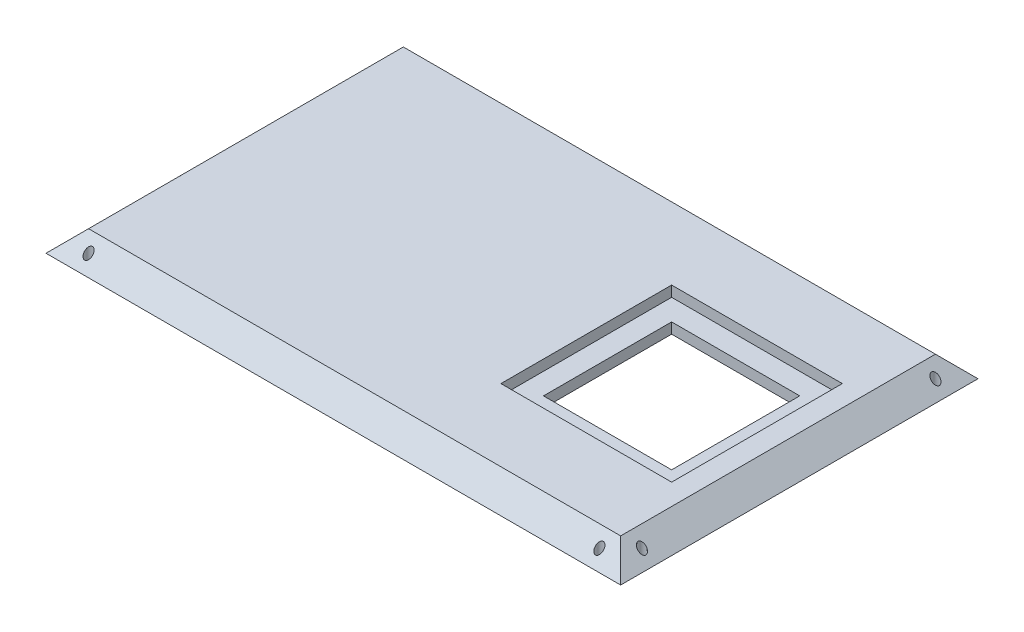
from build123d import *

# Parameters (mm, degrees)
SKETCH_3_R          = 1.85
CUT_EXTRUDE_1_DEPTH = 160.279136005


with BuildPart() as part:
    # Эскиз1 → Loft 1 section 0
    with BuildSketch(Plane(origin=(0, 0, 0), x_dir=(1, 0, 0), z_dir=(0, 1, 0))):
        with BuildLine():
            Line((-134.995764294, -83.940376122), (134.995764294, -83.940376122))
            Line((134.995764294, -83.940376122), (134.995764294, 83.940376122))
            Line((134.995764294, 83.940376122), (-134.995764294, 83.940376122))
            Line((-134.995764294, 83.940376122), (-134.995764294, -83.940376122))
        make_face()
    # Эскиз2 → Loft 1 section 1
    with BuildSketch(Plane(origin=(0, 10, 0), x_dir=(1, 0, 0), z_dir=(0, 1, 0))):
        with BuildLine():
            Line((-124.995764294, 73.940376122), (-124.995764294, -73.940376122))
            Line((-124.995764294, -73.940376122), (124.995764294, -73.940376122))
            Line((124.995764294, -73.940376122), (124.995764294, 73.940376122))
            Line((124.995764294, 73.940376122), (-124.995764294, 73.940376122))
        make_face()
    loft()

    # Эскиз3 → Вырез-Вытянуть1 (cut, through all)
    with BuildSketch(Plane.XZ):
        with Locations(Location((-119.995764294, 78.940376122, 0), (0, 0, 270))):
            Circle(SKETCH_3_R)
        with Locations(Location((-129.995764294, 68.940376122, 0), (0, 0, 180))):
            Circle(SKETCH_3_R)
        with Locations(Location((129.995764294, 68.940376122, 0), (0, 0, 270))):
            Circle(SKETCH_3_R)
        with Locations(Location((119.995764294, 78.940376122, 0), (0, 0, 90))):
            Circle(SKETCH_3_R)
        with Locations((129.995764294, -68.940376122)):
            Circle(SKETCH_3_R)
        with Locations(Location((119.995764294, -78.940376122, 0), (0, 0, 270))):
            Circle(SKETCH_3_R)
        with Locations(Location((-129.995764294, -68.940376122, 0), (0, 0, 270))):
            Circle(SKETCH_3_R)
        with Locations(Location((-119.995764294, -78.940376122, 0), (0, 0, 270))):
            Circle(SKETCH_3_R)
    extrude(amount=-CUT_EXTRUDE_1_DEPTH, mode=Mode.SUBTRACT)

    # Эскиз7 → Loft 1 2 section 0
    with BuildSketch(Plane(origin=(0, 0, 0), x_dir=(1, 0, 0), z_dir=(0, 1, 0))):
        with BuildLine():
            Line((105.095764294, -30.1), (105.095764294, 30.1))
            Line((105.095764294, 30.1), (44.895764294, 30.1))
            Line((44.895764294, 30.1), (44.895764294, -30.1))
            Line((44.895764294, -30.1), (105.095764294, -30.1))
        make_face()
    # Эскиз6 → Loft 1 2 section 1
    with BuildSketch(Plane(origin=(0, 5, 0), x_dir=(1, 0, 0), z_dir=(0, 1, 0))):
        with BuildLine():
            Line((105.095764294, -30.1), (44.895764294, -30.1))
            Line((44.895764294, -30.1), (44.895764294, 30.1))
            Line((44.895764294, 30.1), (105.095764294, 30.1))
            Line((105.095764294, 30.1), (105.095764294, -30.1))
        make_face()
    loft(mode=Mode.SUBTRACT)

    # Эскиз6<3> → Вырез-По сечениям2 section 0
    with BuildSketch(Plane(origin=(0, 5, 0), x_dir=(1, 0, 0), z_dir=(0, 1, 0))):
        with BuildLine():
            Line((115.095764294, 40.1), (34.895764294, 40.1))
            Line((34.895764294, 40.1), (34.895764294, -40.1))
            Line((34.895764294, -40.1), (115.095764294, -40.1))
            Line((115.095764294, -40.1), (115.095764294, 40.1))
        make_face()
    # Эскиз4 → Вырез-По сечениям2 section 1
    with BuildSketch(Plane(origin=(0, 10, 0), x_dir=(1, 0, 0), z_dir=(0, 1, 0))):
        with BuildLine():
            Line((115.095764294, -40.1), (34.895764294, -40.1))
            Line((34.895764294, -40.1), (34.895764294, 40.1))
            Line((34.895764294, 40.1), (115.095764294, 40.1))
            Line((115.095764294, 40.1), (115.095764294, -40.1))
        make_face()
    loft(mode=Mode.SUBTRACT)


solid = part.part
